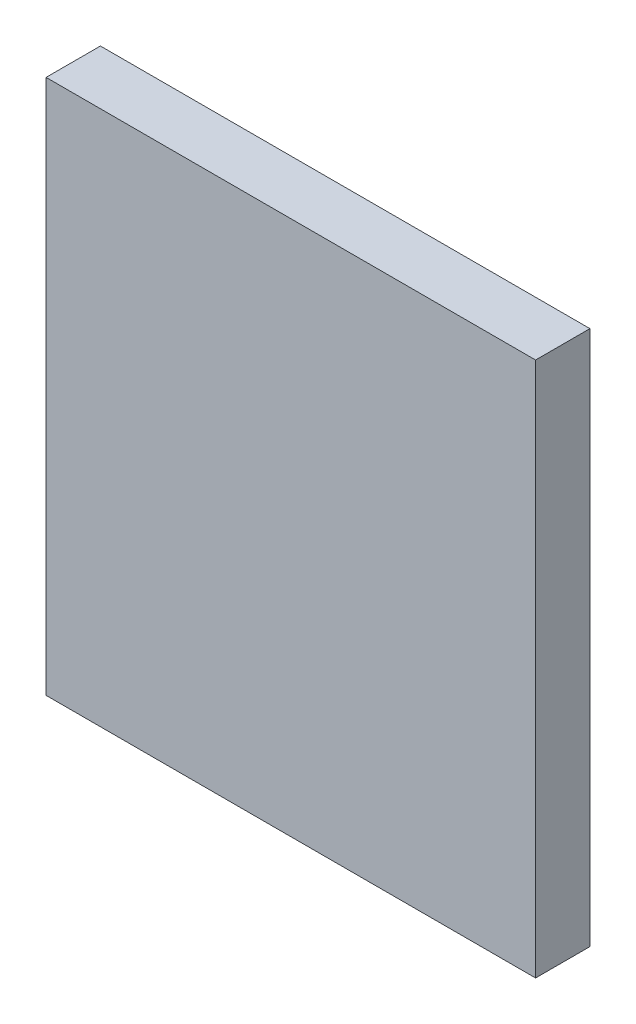
from build123d import *

# Parameters (mm, degrees)
SKIZZE1_W               = 9.0089
SKIZZE1_H               = 9.850003
COMPONENT_OUTLINE_DEPTH = 1


with BuildPart() as part:
    # Skizze1 → Component_Outline (new body)
    with BuildSketch(Plane.XY):
        with Locations((-1.89725, 0.0251015)):
            Rectangle(SKIZZE1_W, SKIZZE1_H)
    extrude(amount=COMPONENT_OUTLINE_DEPTH)


solid = part.part
